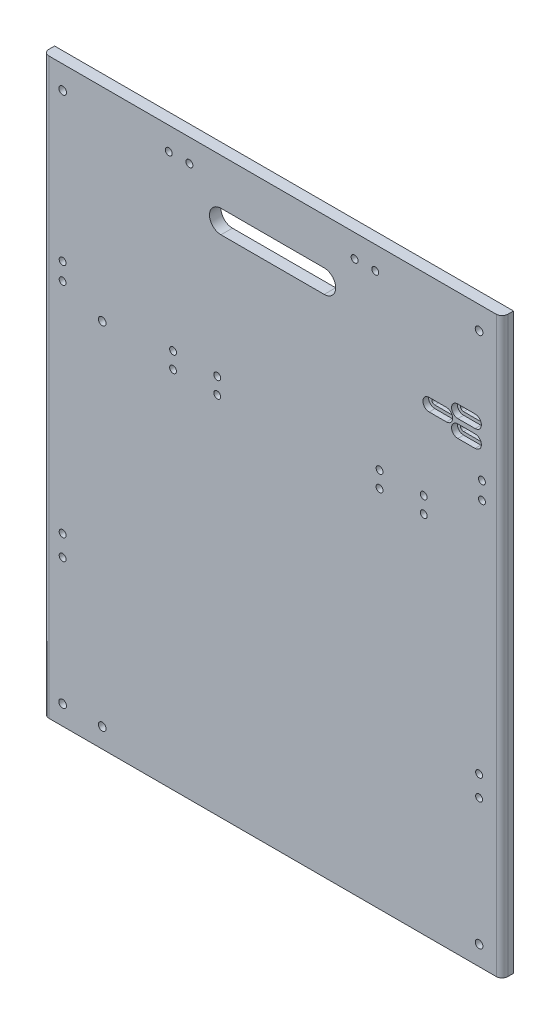
from build123d import *

# Parameters (mm, degrees)
SKETCH1_W           = 400
SKETCH1_H           = 500
BOSS_EXTRUDE1_DEPTH = 10
CUT_EXTRUDE12_DEPTH = 20
FILLET2_R           = 5
CUT_EXTRUDE16_DEPTH = 32
SKETCH19_R          = 3
SKETCH19_R_2        = 3.35
CUT_EXTRUDE17_DEPTH = 124
CUT_EXTRUDE18_DEPTH = 5


with BuildPart() as part:
    # Sketch1 → Boss-Extrude1 (new body)
    with BuildSketch(Plane.XY):
        with Locations((200, 250)):
            Rectangle(SKETCH1_W, SKETCH1_H)
    extrude(amount=BOSS_EXTRUDE1_DEPTH)

    # Sketch15 → Cut-Extrude12 (cut)
    with BuildSketch(Plane.XY.offset(10)):
        with BuildLine():
            Line((155, 460), (245, 460))
            ThreePointArc((245, 460), (255, 450), (245, 440))
            Line((245, 440), (155, 440))
            ThreePointArc((155, 440), (145, 450), (155, 460))
        make_face()
    extrude(amount=-CUT_EXTRUDE12_DEPTH, mode=Mode.SUBTRACT)

    # Fillet2
    fillet2_edges = [part.edges().sort_by_distance(p)[0] for p in [
        (0, 250, 10),
        (400, 250, 10),
    ]]
    fillet(fillet2_edges, radius=FILLET2_R)

    # Sketch18 → Cut-Extrude16 (cut)
    with BuildSketch(Plane.XY.offset(10)):
        with BuildLine():
            Line((351.5, 399.75), (336.5, 399.75))
            ThreePointArc((336.5, 399.75), (333.75, 402.5), (336.5, 405.25))
            Line((336.5, 405.25), (351.5, 405.25))
            ThreePointArc((351.5, 405.25), (354.25, 402.5), (351.5, 399.75))
        make_face()
        with BuildLine():
            Line((376.5, 407.25), (361.5, 407.25))
            ThreePointArc((361.5, 407.25), (358.75, 410), (361.5, 412.75))
            Line((361.5, 412.75), (376.5, 412.75))
            ThreePointArc((376.5, 412.75), (379.25, 410), (376.5, 407.25))
        make_face()
        with BuildLine():
            Line((376.5, 392.25), (361.5, 392.25))
            ThreePointArc((361.5, 392.25), (358.75, 395), (361.5, 397.75))
            Line((361.5, 397.75), (376.5, 397.75))
            ThreePointArc((376.5, 397.75), (379.25, 395), (376.5, 392.25))
        make_face()
    extrude(amount=-CUT_EXTRUDE16_DEPTH, mode=Mode.SUBTRACT)

    # Sketch19 → Cut-Extrude17 (cut)
    with BuildSketch(Plane(origin=(0, 0, 0), x_dir=(-1, 0, 0), z_dir=(0, 0, -1))):
        with Locations((-380, 145.5)):
            Circle(SKETCH19_R)
        with Locations((-380, 127.5)):
            Circle(SKETCH19_R)
        with Locations((-380, 17)):
            Circle(SKETCH19_R_2)
        with Locations((-17, 17)):
            Circle(SKETCH19_R_2)
        with Locations((-17, 145.5)):
            Circle(SKETCH19_R)
        with Locations((-17, 127.5)):
            Circle(SKETCH19_R)
        with Locations((-113.25, 317.5)):
            Circle(SKETCH19_R)
        with Locations((-113.25, 331.5)):
            Circle(SKETCH19_R)
        with Locations((-151.75, 317.5)):
            Circle(SKETCH19_R)
        with Locations((-151.75, 331.5)):
            Circle(SKETCH19_R)
        with Locations((-293.25, 317.5)):
            Circle(SKETCH19_R)
        with Locations((-293.25, 331.5)):
            Circle(SKETCH19_R)
        with Locations((-331.75, 317.5)):
            Circle(SKETCH19_R)
        with Locations((-331.75, 331.5)):
            Circle(SKETCH19_R)
        with Locations((-17, 336)):
            Circle(SKETCH19_R)
        with Locations((-17, 351)):
            Circle(SKETCH19_R)
        with Locations((-17, 480)):
            Circle(SKETCH19_R_2)
        with Locations((-109.5, 480)):
            Circle(SKETCH19_R)
        with Locations((-127.5, 480)):
            Circle(SKETCH19_R)
        with Locations((-271.5, 480)):
            Circle(SKETCH19_R)
        with Locations((-289.5, 480)):
            Circle(SKETCH19_R)
        with Locations((-380, 480)):
            Circle(SKETCH19_R_2)
        with Locations((-382.5, 353.25)):
            Circle(SKETCH19_R)
        with Locations((-382.5, 368.25)):
            Circle(SKETCH19_R)
        with Locations((-51.5, 323)):
            Circle(SKETCH19_R_2)
        with Locations((-51.5, 17)):
            Circle(SKETCH19_R_2)
    extrude(amount=-CUT_EXTRUDE17_DEPTH, mode=Mode.SUBTRACT)

    # Sketch18<4> → Cut-Extrude18 (cut)
    # profile 1 of 3: a face of its own
    with BuildSketch(Plane.XY.offset(10)):
        with BuildLine():
            Line((351.5, 397), (336.5, 397))
            ThreePointArc((336.5, 397), (331, 402.5), (336.5, 408))
            Line((336.5, 408), (351.5, 408))
            ThreePointArc((351.5, 408), (357, 402.5), (351.5, 397))
        make_face()
        with BuildLine():
            Line((351.5, 399.75), (336.5, 399.75))
            ThreePointArc((336.5, 399.75), (333.75, 402.5), (336.5, 405.25))
            Line((336.5, 405.25), (351.5, 405.25))
            ThreePointArc((351.5, 405.25), (354.25, 402.5), (351.5, 399.75))
        make_face(mode=Mode.SUBTRACT)
    # profile 2 of 3: a face of its own
    with BuildSketch(Plane.XY.offset(10)):
        with BuildLine():
            Line((376.5, 404.5), (361.5, 404.5))
            ThreePointArc((361.5, 404.5), (356, 410), (361.5, 415.5))
            Line((361.5, 415.5), (376.5, 415.5))
            ThreePointArc((376.5, 415.5), (382, 410), (376.5, 404.5))
        make_face()
        with BuildLine():
            Line((376.5, 407.25), (361.5, 407.25))
            ThreePointArc((361.5, 407.25), (358.75, 410), (361.5, 412.75))
            Line((361.5, 412.75), (376.5, 412.75))
            ThreePointArc((376.5, 412.75), (379.25, 410), (376.5, 407.25))
        make_face(mode=Mode.SUBTRACT)
    # profile 3 of 3: a face of its own
    with BuildSketch(Plane.XY.offset(10)):
        with BuildLine():
            Line((376.5, 389.5), (361.5, 389.5))
            ThreePointArc((361.5, 389.5), (356, 395), (361.5, 400.5))
            Line((361.5, 400.5), (376.5, 400.5))
            ThreePointArc((376.5, 400.5), (382, 395), (376.5, 389.5))
        make_face()
        with BuildLine():
            Line((376.5, 392.25), (361.5, 392.25))
            ThreePointArc((361.5, 392.25), (358.75, 395), (361.5, 397.75))
            Line((361.5, 397.75), (376.5, 397.75))
            ThreePointArc((376.5, 397.75), (379.25, 395), (376.5, 392.25))
        make_face(mode=Mode.SUBTRACT)
    extrude(amount=-CUT_EXTRUDE18_DEPTH, mode=Mode.SUBTRACT)


solid = part.part
